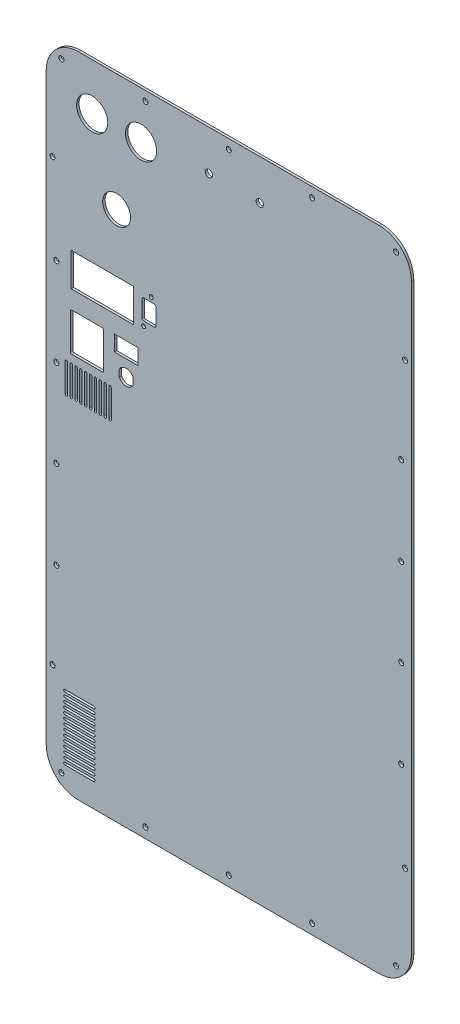
from build123d import *

# Parameters (mm, degrees)
CROQUIS2_R              = 2.095
SALIENTE_EXTRUIR1_DEPTH = 2
CROQUIS3_R              = 12.85
CROQUIS3_R_2            = 3
CROQUIS3_R_3            = 11.5
CROQUIS3_R_4            = 1.625
CROQUIS3_W              = 51.3
CROQUIS3_H              = 27.5
CROQUIS3_W_2            = 19.3
CROQUIS3_H_2            = 12.9
CORTAR_EXTRUIR1_DEPTH   = 307.880733551
CORTAR_EXTRUIR2_DEPTH   = 307.880733551


with BuildPart() as part:
    # Croquis2 → Saliente-Extruir1 (new body)
    with BuildSketch(Plane.XY):
        with BuildLine():
            Line((-123.95, -267.345), (123.95, -267.345))
            ThreePointArc((123.95, -267.345), (142.836822125, -259.521822125), (150.66, -240.635))
            Line((150.66, -240.635), (150.66, 240.635))
            ThreePointArc((150.66, 240.635), (142.836822125, 259.521822125), (123.95, 267.345))
            Line((123.95, 267.345), (-123.95, 267.345))
            ThreePointArc((-123.95, 267.345), (-142.836822125, 259.521822125), (-150.66, 240.635))
            Line((-150.66, 240.635), (-150.66, -240.635))
            ThreePointArc((-150.66, -240.635), (-142.836822125, -259.521822125), (-123.95, -267.345))
        make_face()
        with Locations((0, 259.475)):
            Circle(CROQUIS2_R, mode=Mode.SUBTRACT)
        with Locations((-68.8, 259.475)):
            Circle(CROQUIS2_R, mode=Mode.SUBTRACT)
        with Locations((-138.07, 255.285)):
            Circle(CROQUIS2_R, mode=Mode.SUBTRACT)
        with Locations((-142.26, 36.35)):
            Circle(CROQUIS2_R, mode=Mode.SUBTRACT)
        with Locations((-142.26, 109.06)):
            Circle(CROQUIS2_R, mode=Mode.SUBTRACT)
        with Locations((-145.44, 181.77)):
            Circle(CROQUIS2_R, mode=Mode.SUBTRACT)
        with Locations(Location((142.26, 36.35, 0), (0, 0, 180))):
            Circle(CROQUIS2_R, mode=Mode.SUBTRACT)
        with Locations(Location((142.26, 109.06, 0), (0, 0, 180))):
            Circle(CROQUIS2_R, mode=Mode.SUBTRACT)
        with Locations(Location((145.44, 181.77, 0), (0, 0, 180))):
            Circle(CROQUIS2_R, mode=Mode.SUBTRACT)
        with Locations(Location((138.07, 255.285, 0), (0, 0, 180))):
            Circle(CROQUIS2_R, mode=Mode.SUBTRACT)
        with Locations(Location((68.8, 259.475, 0), (0, 0, 180))):
            Circle(CROQUIS2_R, mode=Mode.SUBTRACT)
        with Locations((142.26, -35.85)):
            Circle(CROQUIS2_R, mode=Mode.SUBTRACT)
        with Locations((142.26, -108.56)):
            Circle(CROQUIS2_R, mode=Mode.SUBTRACT)
        with Locations((145.44, -181.27)):
            Circle(CROQUIS2_R, mode=Mode.SUBTRACT)
        with Locations((138.07, -254.785)):
            Circle(CROQUIS2_R, mode=Mode.SUBTRACT)
        with Locations((68.8, -258.975)):
            Circle(CROQUIS2_R, mode=Mode.SUBTRACT)
        with Locations(Location((0, -258.975, 0), (0, 0, 180))):
            Circle(CROQUIS2_R, mode=Mode.SUBTRACT)
        with Locations(Location((-68.8, -258.975, 0), (0, 0, 180))):
            Circle(CROQUIS2_R, mode=Mode.SUBTRACT)
        with Locations(Location((-138.07, -254.785, 0), (0, 0, 180))):
            Circle(CROQUIS2_R, mode=Mode.SUBTRACT)
        with Locations(Location((-145.44, -181.27, 0), (0, 0, 180))):
            Circle(CROQUIS2_R, mode=Mode.SUBTRACT)
        with Locations(Location((-142.26, -108.56, 0), (0, 0, 180))):
            Circle(CROQUIS2_R, mode=Mode.SUBTRACT)
        with Locations(Location((-142.26, -35.85, 0), (0, 0, 180))):
            Circle(CROQUIS2_R, mode=Mode.SUBTRACT)
    extrude(amount=SALIENTE_EXTRUIR1_DEPTH)

    # Croquis3 → Cortar-Extruir1 (cut, through all)
    with BuildSketch(Plane.XY.offset(2)):
        with Locations((-112.69, 228.595)):
            Circle(CROQUIS3_R)
        with Locations((-72.42, 228.595)):
            Circle(CROQUIS3_R)
        with Locations((-16.43, 234.145)):
            Circle(CROQUIS3_R_2)
        with Locations((25.57, 234.145)):
            Circle(CROQUIS3_R_2)
        with Locations((-92.56, 170.375)):
            Circle(CROQUIS3_R_3)
        with Locations((-63.965, 122.1)):
            Circle(CROQUIS3_R_4)
        with Locations((-70.315, 98.1)):
            Circle(CROQUIS3_R_4)
        with BuildLine():
            Line((-78.845590111, 57.074463135), (-78.844409901, 57.075))
            ThreePointArc((-78.844409901, 57.075), (-84.67, 60.825), (-90.495590099, 57.075))
            Line((-90.495590099, 57.075), (-90.495590099, 51.775))
            ThreePointArc((-90.495590099, 51.775), (-84.67, 48.025), (-78.844409901, 51.775))
            Line((-78.844409901, 51.775), (-78.845590111, 51.775536865))
            Line((-78.845590111, 51.775536865), (-78.845590111, 57.074463135))
        make_face()
        with Locations((-104.47, 108.715)):
            Rectangle(CROQUIS3_W, CROQUIS3_H)
        with BuildLine():
            Line((-129.72, 80.025), (-104.42, 80.025))
            ThreePointArc((-104.42, 80.025), (-103.712893219, 79.732106781), (-103.42, 79.025))
            Line((-103.42, 79.025), (-103.42, 49.425))
            ThreePointArc((-103.42, 49.425), (-103.712893219, 48.717893219), (-104.42, 48.425))
            Line((-104.42, 48.425), (-129.72, 48.425))
            ThreePointArc((-129.72, 48.425), (-130.427106781, 48.717893219), (-130.72, 49.425))
            Line((-130.72, 49.425), (-130.72, 79.025))
            ThreePointArc((-130.72, 79.025), (-130.427106781, 79.732106781), (-129.72, 80.025))
        make_face()
        with Locations((-84.68, 74.075)):
            Rectangle(CROQUIS3_W_2, CROQUIS3_H_2)
        with BuildLine():
            Line((-70.21, 118.375), (-61.42, 118.375))
            ThreePointArc((-61.42, 118.375), (-60.444192642, 117.970807358), (-60.04, 116.995))
            Line((-60.04, 116.995), (-60.04, 103.205))
            ThreePointArc((-60.04, 103.205), (-60.444192642, 102.229192642), (-61.42, 101.825))
            Line((-61.42, 101.825), (-70.21, 101.825))
            ThreePointArc((-70.21, 101.825), (-71.185807358, 102.229192642), (-71.59, 103.205))
            Line((-71.59, 103.205), (-71.59, 116.995))
            ThreePointArc((-71.59, 116.995), (-71.185807358, 117.970807358), (-70.21, 118.375))
        make_face()
    extrude(amount=-CORTAR_EXTRUIR1_DEPTH, mode=Mode.SUBTRACT)

    # Croquis4 → Cortar-Extruir2 (cut, through all)
    with BuildSketch(Plane.XY.offset(2)):
        with BuildLine():
            Line((-132.97, 40.945), (-132.97, 17.475))
            ThreePointArc((-132.97, 17.475), (-133.97, 16.475), (-134.97, 17.475))
            Line((-134.97, 17.475), (-134.97, 40.945))
            ThreePointArc((-134.97, 40.945), (-133.97, 41.945), (-132.97, 40.945))
        make_face()
        with BuildLine():
            Line((-128.97, 40.945), (-128.97, 17.475))
            ThreePointArc((-128.97, 17.475), (-129.97, 16.475), (-130.97, 17.475))
            Line((-130.97, 17.475), (-130.97, 40.945))
            ThreePointArc((-130.97, 40.945), (-129.97, 41.945), (-128.97, 40.945))
        make_face()
        with BuildLine():
            Line((-124.97, 40.945), (-124.97, 17.475))
            ThreePointArc((-124.97, 17.475), (-125.97, 16.475), (-126.97, 17.475))
            Line((-126.97, 17.475), (-126.97, 40.945))
            ThreePointArc((-126.97, 40.945), (-125.97, 41.945), (-124.97, 40.945))
        make_face()
        with BuildLine():
            Line((-120.97, 40.945), (-120.97, 17.475))
            ThreePointArc((-120.97, 17.475), (-121.97, 16.475), (-122.97, 17.475))
            Line((-122.97, 17.475), (-122.97, 40.945))
            ThreePointArc((-122.97, 40.945), (-121.97, 41.945), (-120.97, 40.945))
        make_face()
        with BuildLine():
            Line((-116.97, 40.945), (-116.97, 17.475))
            ThreePointArc((-116.97, 17.475), (-117.97, 16.475), (-118.97, 17.475))
            Line((-118.97, 17.475), (-118.97, 40.945))
            ThreePointArc((-118.97, 40.945), (-117.97, 41.945), (-116.97, 40.945))
        make_face()
        with BuildLine():
            Line((-112.97, 40.945), (-112.97, 17.475))
            ThreePointArc((-112.97, 17.475), (-113.97, 16.475), (-114.97, 17.475))
            Line((-114.97, 17.475), (-114.97, 40.945))
            ThreePointArc((-114.97, 40.945), (-113.97, 41.945), (-112.97, 40.945))
        make_face()
        with BuildLine():
            Line((-108.97, 40.945), (-108.97, 17.475))
            ThreePointArc((-108.97, 17.475), (-109.97, 16.475), (-110.97, 17.475))
            Line((-110.97, 17.475), (-110.97, 40.945))
            ThreePointArc((-110.97, 40.945), (-109.97, 41.945), (-108.97, 40.945))
        make_face()
        with BuildLine():
            Line((-104.97, 40.945), (-104.97, 17.475))
            ThreePointArc((-104.97, 17.475), (-105.97, 16.475), (-106.97, 17.475))
            Line((-106.97, 17.475), (-106.97, 40.945))
            ThreePointArc((-106.97, 40.945), (-105.97, 41.945), (-104.97, 40.945))
        make_face()
        with BuildLine():
            Line((-100.97, 40.945), (-100.97, 17.475))
            ThreePointArc((-100.97, 17.475), (-101.97, 16.475), (-102.97, 17.475))
            Line((-102.97, 17.475), (-102.97, 40.945))
            ThreePointArc((-102.97, 40.945), (-101.97, 41.945), (-100.97, 40.945))
        make_face()
        with BuildLine():
            Line((-96.97, 40.945), (-96.97, 17.475))
            ThreePointArc((-96.97, 17.475), (-97.97, 16.475), (-98.97, 17.475))
            Line((-98.97, 17.475), (-98.97, 40.945))
            ThreePointArc((-98.97, 40.945), (-97.97, 41.945), (-96.97, 40.945))
        make_face()
        with BuildLine():
            Line((-135.21, -245.835), (-111.31, -245.835))
            ThreePointArc((-111.31, -245.835), (-110.31, -246.835), (-111.31, -247.835))
            Line((-111.31, -247.835), (-135.21, -247.835))
            ThreePointArc((-135.21, -247.835), (-136.21, -246.835), (-135.21, -245.835))
        make_face()
        with BuildLine():
            Line((-135.21, -241.835), (-111.31, -241.835))
            ThreePointArc((-111.31, -241.835), (-110.31, -242.835), (-111.31, -243.835))
            Line((-111.31, -243.835), (-135.21, -243.835))
            ThreePointArc((-135.21, -243.835), (-136.21, -242.835), (-135.21, -241.835))
        make_face()
        with BuildLine():
            Line((-135.21, -237.835), (-111.31, -237.835))
            ThreePointArc((-111.31, -237.835), (-110.31, -238.835), (-111.31, -239.835))
            Line((-111.31, -239.835), (-135.21, -239.835))
            ThreePointArc((-135.21, -239.835), (-136.21, -238.835), (-135.21, -237.835))
        make_face()
        with BuildLine():
            Line((-135.21, -233.835), (-111.31, -233.835))
            ThreePointArc((-111.31, -233.835), (-110.31, -234.835), (-111.31, -235.835))
            Line((-111.31, -235.835), (-135.21, -235.835))
            ThreePointArc((-135.21, -235.835), (-136.21, -234.835), (-135.21, -233.835))
        make_face()
        with BuildLine():
            Line((-135.21, -229.835), (-111.31, -229.835))
            ThreePointArc((-111.31, -229.835), (-110.31, -230.835), (-111.31, -231.835))
            Line((-111.31, -231.835), (-135.21, -231.835))
            ThreePointArc((-135.21, -231.835), (-136.21, -230.835), (-135.21, -229.835))
        make_face()
        with BuildLine():
            Line((-135.21, -225.835), (-111.31, -225.835))
            ThreePointArc((-111.31, -225.835), (-110.31, -226.835), (-111.31, -227.835))
            Line((-111.31, -227.835), (-135.21, -227.835))
            ThreePointArc((-135.21, -227.835), (-136.21, -226.835), (-135.21, -225.835))
        make_face()
        with BuildLine():
            Line((-135.21, -221.835), (-111.31, -221.835))
            ThreePointArc((-111.31, -221.835), (-110.31, -222.835), (-111.31, -223.835))
            Line((-111.31, -223.835), (-135.21, -223.835))
            ThreePointArc((-135.21, -223.835), (-136.21, -222.835), (-135.21, -221.835))
        make_face()
        with BuildLine():
            Line((-135.21, -217.835), (-111.31, -217.835))
            ThreePointArc((-111.31, -217.835), (-110.31, -218.835), (-111.31, -219.835))
            Line((-111.31, -219.835), (-135.21, -219.835))
            ThreePointArc((-135.21, -219.835), (-136.21, -218.835), (-135.21, -217.835))
        make_face()
        with BuildLine():
            Line((-135.21, -213.835), (-111.31, -213.835))
            ThreePointArc((-111.31, -213.835), (-110.31, -214.835), (-111.31, -215.835))
            Line((-111.31, -215.835), (-135.21, -215.835))
            ThreePointArc((-135.21, -215.835), (-136.21, -214.835), (-135.21, -213.835))
        make_face()
        with BuildLine():
            Line((-135.21, -209.835), (-111.31, -209.835))
            ThreePointArc((-111.31, -209.835), (-110.31, -210.835), (-111.31, -211.835))
            Line((-111.31, -211.835), (-135.21, -211.835))
            ThreePointArc((-135.21, -211.835), (-136.21, -210.835), (-135.21, -209.835))
        make_face()
        with BuildLine():
            Line((-135.21, -205.835), (-111.31, -205.835))
            ThreePointArc((-111.31, -205.835), (-110.31, -206.835), (-111.31, -207.835))
            Line((-111.31, -207.835), (-135.21, -207.835))
            ThreePointArc((-135.21, -207.835), (-136.21, -206.835), (-135.21, -205.835))
        make_face()
        with BuildLine():
            Line((-135.21, -201.835), (-111.31, -201.835))
            ThreePointArc((-111.31, -201.835), (-110.31, -202.835), (-111.31, -203.835))
            Line((-111.31, -203.835), (-135.21, -203.835))
            ThreePointArc((-135.21, -203.835), (-136.21, -202.835), (-135.21, -201.835))
        make_face()
        with BuildLine():
            Line((-135.21, -197.835), (-111.31, -197.835))
            ThreePointArc((-111.31, -197.835), (-110.31, -198.835), (-111.31, -199.835))
            Line((-111.31, -199.835), (-135.21, -199.835))
            ThreePointArc((-135.21, -199.835), (-136.21, -198.835), (-135.21, -197.835))
        make_face()
        with BuildLine():
            Line((-135.21, -193.835), (-111.31, -193.835))
            ThreePointArc((-111.31, -193.835), (-110.31, -194.835), (-111.31, -195.835))
            Line((-111.31, -195.835), (-135.21, -195.835))
            ThreePointArc((-135.21, -195.835), (-136.21, -194.835), (-135.21, -193.835))
        make_face()
    extrude(amount=-CORTAR_EXTRUIR2_DEPTH, mode=Mode.SUBTRACT)


solid = part.part
